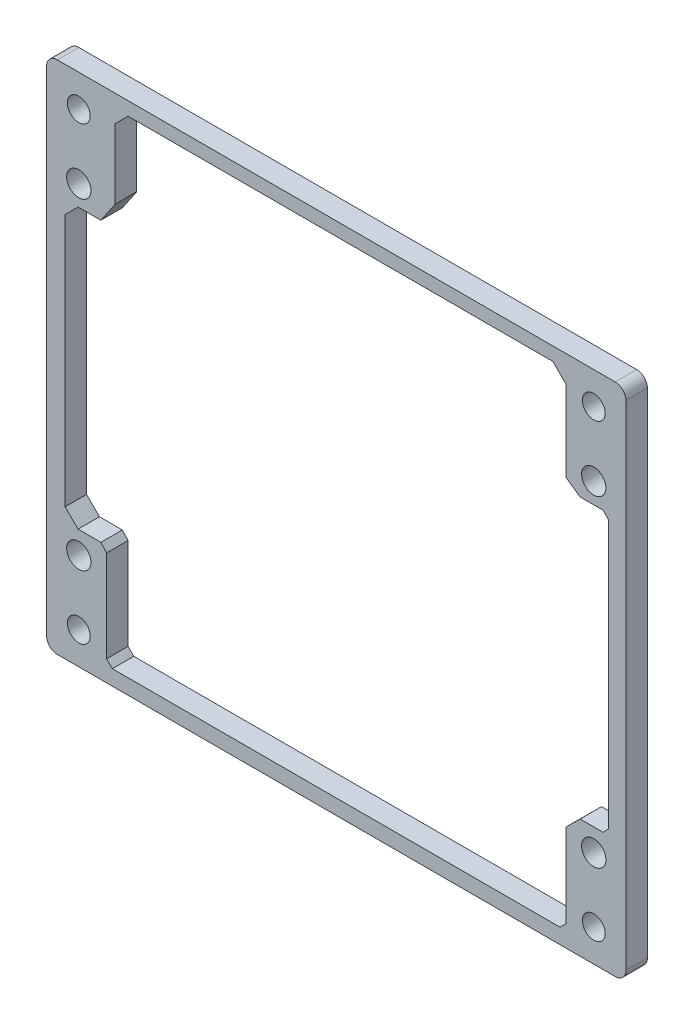
from build123d import *

# Parameters (mm, degrees)
MODEL_R                 = 1.7
MODEL_R_2               = 1.600279216
SALIENTE_EXTRUIR1_DEPTH = 3


with BuildPart() as part:
    # Model → Saliente-Extruir1 (new body)
    with BuildSketch(Plane.XY):
        with BuildLine():
            Line((60.263543448, -46.554934941), (60.263543448, -115.557339175))
            ThreePointArc((60.263543448, -115.557339175), (60.702883276, -116.617999347), (61.763543448, -117.057339175))
            Line((61.763543448, -117.057339175), (139.768153306, -117.057339175))
            ThreePointArc((139.768153306, -117.057339175), (140.828813478, -116.617999347), (141.268153306, -115.557339175))
            Line((141.268153306, -115.557339175), (141.268153306, -46.554934941))
            ThreePointArc((141.268153306, -46.554934941), (140.828813478, -45.494274769), (139.768153306, -45.054934941))
            Line((139.768153306, -45.054934941), (61.763543448, -45.054934941))
            ThreePointArc((61.763543448, -45.054934941), (60.702883276, -45.494274769), (60.263543448, -46.554934941))
        make_face()
        with Locations((136.768487808, -103.558008179)):
            Circle(MODEL_R, mode=Mode.SUBTRACT)
        with Locations((136.768487808, -58.554600438)):
            Circle(MODEL_R, mode=Mode.SUBTRACT)
        with Locations((136.768487808, -112.557673677)):
            Circle(MODEL_R_2, mode=Mode.SUBTRACT)
        with Locations((136.768487808, -49.554934941)):
            Circle(MODEL_R_2, mode=Mode.SUBTRACT)
        with Locations((64.763543448, -103.558008179)):
            Circle(MODEL_R, mode=Mode.SUBTRACT)
        with Locations((64.763543448, -58.554600438)):
            Circle(MODEL_R, mode=Mode.SUBTRACT)
        with Locations((64.763543448, -49.554934941)):
            Circle(MODEL_R_2, mode=Mode.SUBTRACT)
        with Locations((64.763543448, -112.557673677)):
            Circle(MODEL_R_2, mode=Mode.SUBTRACT)
        Polygon((71.651345037, -46.935116153), (131.055954895, -46.935116153), (132.855954895, -48.735116152), (132.855954895, -60.048667687), (134.855954895, -61.435116153), (138.055954895, -61.435116153), (138.855954895, -62.235116152), (138.855954895, -99.637520387), (138.055954895, -100.437520387), (134.855954895, -100.437520387), (132.855954895, -102.421405318), (132.855954895, -114.137520387), (132.055954895, -114.937520387), (69.451345037, -114.937520387), (68.651345037, -114.137520387), (68.651345037, -101.317509753), (67.851345037, -100.437520387), (64.651345037, -100.437520387), (62.851345037, -98.637520387), (62.851345037, -63.235116152), (64.651345037, -61.435116153), (67.851345037, -61.435116153), (69.851345037, -58.49810879), (69.851345037, -48.735116152), align=None, mode=Mode.SUBTRACT)
    extrude(amount=SALIENTE_EXTRUIR1_DEPTH)


solid = part.part
